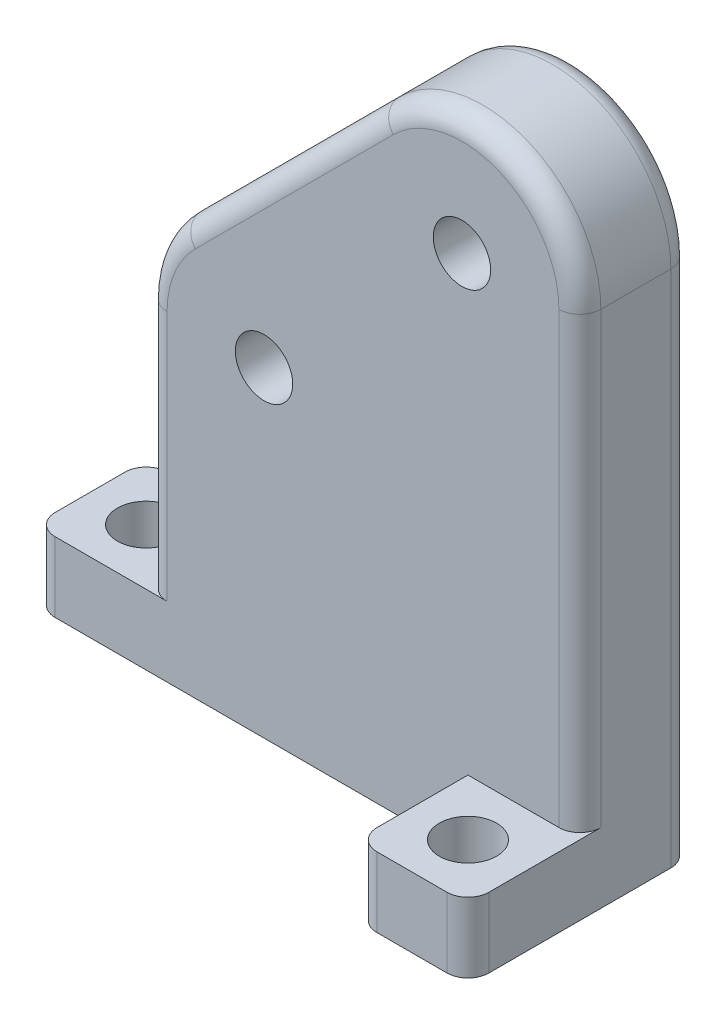
from build123d import *

# Parameters (mm, degrees)
ESQUISSE7_R                  = 2.05
BOSS_EXTRU_1_DEPTH           = 8
ESQUISSE8_W                  = 8
ESQUISSE8_H                  = 5
BOSS_EXTRU_2_DEPTH           = 8
ENL_V_MAT_EXTRU_3_DEPTH      = 59.457249337
ENL_V_MAT_EXTRU_3_DEPTH_BACK = 59.457249337
ESQUISSE9_R                  = 2.05
CONG_5_R                     = 1.5


with BuildPart() as part:
    # Esquisse7 → Boss.-Extru.1 (new body)
    with BuildSketch(Plane.XY):
        with BuildLine():
            Line((0, 0), (39, 0))
            Line((39, 0), (39, 37.071067812))
            ThreePointArc((39, 37.071067812), (33.796680513, 44.858385741), (24.610912703, 43.03122292))
            Line((24.610912703, 43.03122292), (10.46877708, 28.889087297))
            ThreePointArc((10.46877708, 28.889087297), (8.641614259, 26.154544889), (8, 22.928932188))
            Line((8, 22.928932188), (8, 5))
            Line((8, 5), (0, 5))
            Line((0, 5), (0, 0))
        make_face()
        with Locations((16.428932188, 22.928932188)):
            Circle(ESQUISSE7_R, mode=Mode.SUBTRACT)
        with Locations(Location((30.571067812, 37.071067812, 0), (0, 0, 180))):
            Circle(ESQUISSE7_R, mode=Mode.SUBTRACT)
    extrude(amount=BOSS_EXTRU_1_DEPTH)

    # Esquisse8 → Boss.-Extru.2 (add)
    with BuildSketch(Plane.XY.offset(8)):
        with Locations((35, 2.5)):
            Rectangle(ESQUISSE8_W, ESQUISSE8_H)
    extrude(amount=BOSS_EXTRU_2_DEPTH)

    # Esquisse9 → Enlèv. mat.-Extru.3 (cut, two sides: drawn at the far end of the back side and taken through both)
    with BuildSketch(Plane(origin=(0, 5, 0), x_dir=(1, 0, 0), z_dir=(0, 1, 0)).offset(-ENL_V_MAT_EXTRU_3_DEPTH_BACK)):
        with Locations(Location((35, -12, 0), (0, 0, 180))):
            Circle(ESQUISSE9_R)
        with Locations(Location((4, -4, 0), (0, 0, 180))):
            Circle(ESQUISSE9_R)
    extrude(amount=ENL_V_MAT_EXTRU_3_DEPTH + ENL_V_MAT_EXTRU_3_DEPTH_BACK, mode=Mode.SUBTRACT)

    # Congé5
    cong_5_edges = [part.edges().sort_by_distance(p)[0] for p in [
        (33.796680513, 44.858385741, 0),
        (39, 18.535533906, 0),
        (0, 2.5, 0),
        (33.796680513, 44.858385741, 8),
        (17.539844892, 35.960155108, 8),
        (8.641614259, 26.154544889, 8),
        (8, 13.964466094, 8),
        (39, 21.035533906, 8),
        (31, 2.5, 16),
        (39, 2.5, 16),
        (0, 2.5, 8),
        (8, 13.964466094, 0),
        (8.641614259, 26.154544889, 0),
        (17.539844892, 35.960155108, 0),
    ]]
    fillet(cong_5_edges, radius=CONG_5_R)


solid = part.part
